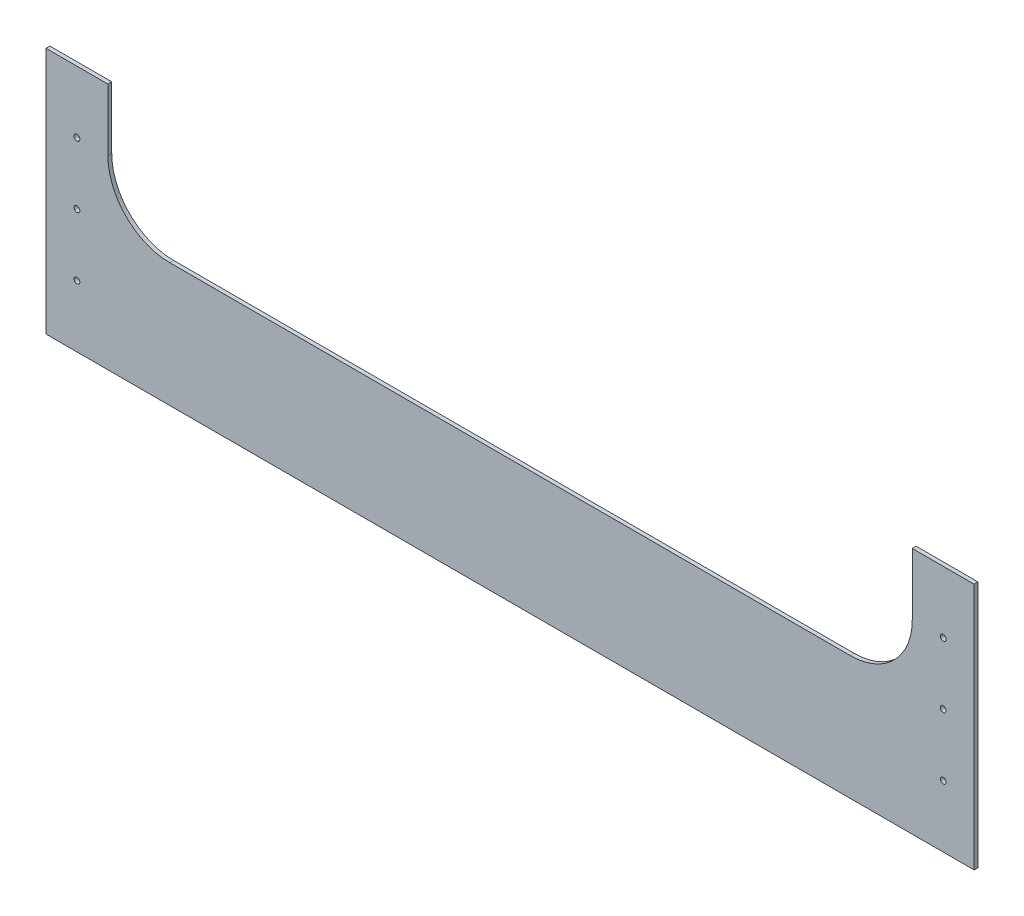
from build123d import *

# Parameters (mm, degrees)
SKETCH1_R           = 2.38125
BOSS_EXTRUDE1_DEPTH = 3.175


with BuildPart() as part:
    # Sketch1 → Boss-Extrude1 (new body)
    with BuildSketch(Plane.XY):
        with BuildLine():
            Line((-381, 0), (381, 0))
            Line((381, 0), (381, 203.2))
            Line((381, 203.2), (330.2, 203.2))
            Line((330.2, 203.2), (330.2, 152.4))
            ThreePointArc((330.2, 152.4), (315.321024484, 116.478975516), (279.4, 101.6))
            Line((279.4, 101.6), (-279.4, 101.6))
            ThreePointArc((-279.4, 101.6), (-315.321024484, 116.478975516), (-330.2, 152.4))
            Line((-330.2, 152.4), (-330.2, 203.2))
            Line((-330.2, 203.2), (-381, 203.2))
            Line((-381, 203.2), (-381, 0))
        make_face()
        with Locations((-355.6, 152.4)):
            Circle(SKETCH1_R, mode=Mode.SUBTRACT)
        with Locations((355.6, 152.4)):
            Circle(SKETCH1_R, mode=Mode.SUBTRACT)
        with Locations((355.6, 101.6)):
            Circle(SKETCH1_R, mode=Mode.SUBTRACT)
        with Locations((355.6, 50.8)):
            Circle(SKETCH1_R, mode=Mode.SUBTRACT)
        with Locations((-355.6, 101.6)):
            Circle(SKETCH1_R, mode=Mode.SUBTRACT)
        with Locations((-355.6, 50.8)):
            Circle(SKETCH1_R, mode=Mode.SUBTRACT)
    extrude(amount=BOSS_EXTRUDE1_DEPTH)


solid = part.part
